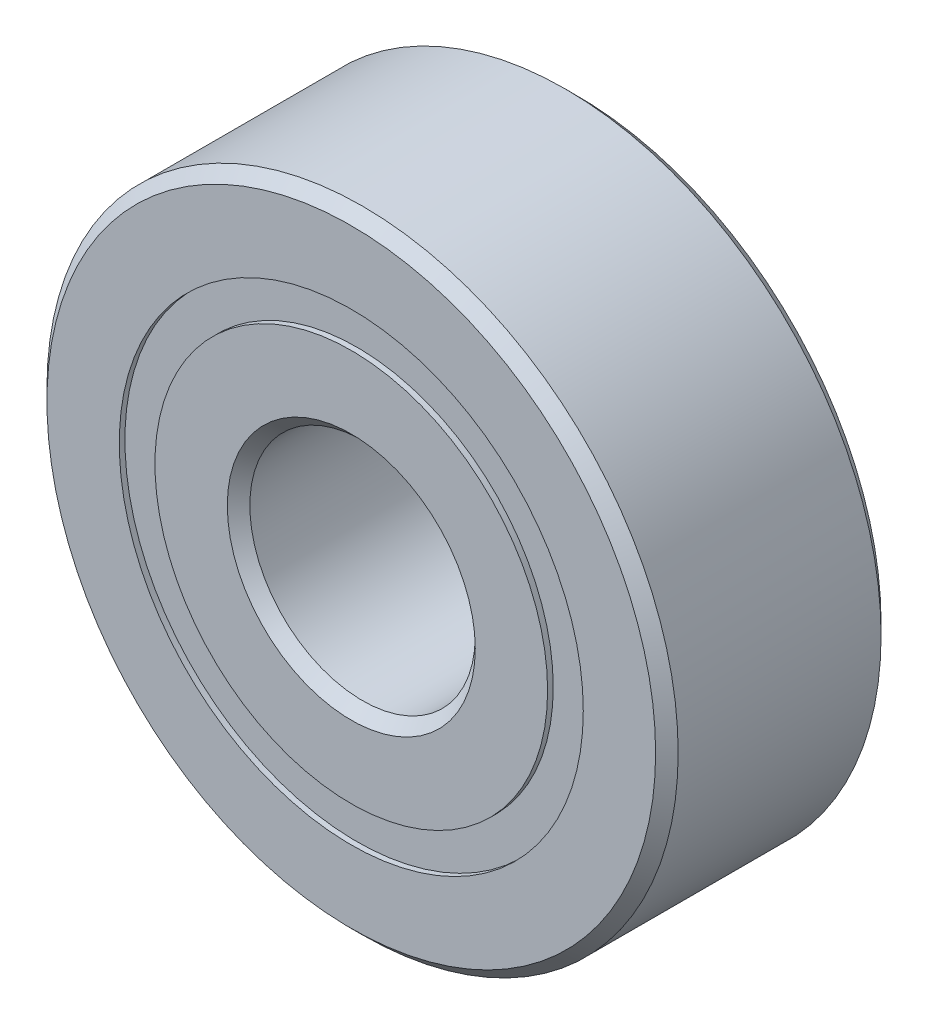
from build123d import *

# Parameters (mm, degrees)
CIRPATTERN1_COUNT = 12
SKETCH5_W         = 1.195563381
SKETCH5_H         = 0.791208792


with BuildPart() as part:
    # Sketch1 → Revolve1 (revolve)
    with BuildSketch(Plane(origin=(0, 0, 0), x_dir=(0, 0, -1), z_dir=(1, 0, 0)), mode=Mode.PRIVATE) as revolve1_sk:
        with BuildLine():
            Line((2.25, 7), (-2.25, 7))
            Line((-2.25, 7), (-2.5, 6.75))
            Line((-2.5, 6.75), (-2.5, 5.145604396))
            Line((-2.5, 5.145604396), (-1.111111111, 5.145604396))
            ThreePointArc((-1.111111111, 5.145604396), (0, 5.929436619), (1.111111111, 5.145604396))
            Line((1.111111111, 5.145604396), (2.5, 5.145604396))
            Line((2.5, 5.145604396), (2.5, 6.75))
            Line((2.5, 6.75), (2.25, 7))
        make_face()
    revolve(revolve1_sk.sketch.rotate(Axis((0, 0, 2.5), (0, 0, -1)), 90), axis=Axis((0, 0, 2.5), (0, 0, -1)))


with BuildPart() as body_2:
    # Sketch3 → Revolve3 (revolve)
    with BuildSketch(Plane(origin=(0, 0, 0), x_dir=(0, 0, -1), z_dir=(1, 0, 0)), mode=Mode.PRIVATE) as revolve3_sk:
        with BuildLine():
            Line((-2.5, 4.354395604), (-1.111111111, 4.354395604))
            ThreePointArc((-1.111111111, 4.354395604), (0, 3.570563381), (1.111111111, 4.354395604))
            Line((1.111111111, 4.354395604), (2.5, 4.354395604))
            Line((2.5, 4.354395604), (2.5, 2.75))
            Line((2.5, 2.75), (2.25, 2.5))
            Line((2.25, 2.5), (-2.25, 2.5))
            Line((-2.25, 2.5), (-2.5, 2.75))
            Line((-2.5, 2.75), (-2.5, 4.354395604))
        make_face()
    revolve(revolve3_sk.sketch.rotate(Axis((0, 0, 2.5), (0, 0, -1)), 90), axis=Axis((0, 0, 2.5), (0, 0, -1)))


with BuildPart() as body_3:
    # Sketch4 → Revolve4 (revolve)
    with BuildSketch(Plane(origin=(0, 0, 0), x_dir=(0, 0, -1), z_dir=(1, 0, 0))):
        with BuildLine():
            Line((-1.179436619, 4.75), (1.179436619, 4.75))
            ThreePointArc((1.179436619, 4.75), (0, 5.929436619), (-1.179436619, 4.75))
        make_face()
    revolve(axis=Axis((0, 4.75, 1.179436619), (0, 0, -1)))


with BuildPart() as cirpattern1_1:
    # CirPattern1: pattern copy
    add(body_3.part.rotate(Axis((0, 0, 0), (0, 0, 1)), 1 * 360 / CIRPATTERN1_COUNT))


with BuildPart() as cirpattern1_2:
    # CirPattern1: pattern copy
    add(body_3.part.rotate(Axis((0, 0, 0), (0, 0, 1)), 2 * 360 / CIRPATTERN1_COUNT))


with BuildPart() as cirpattern1_3:
    # CirPattern1: pattern copy
    add(body_3.part.rotate(Axis((0, 0, 0), (0, 0, 1)), 3 * 360 / CIRPATTERN1_COUNT))


with BuildPart() as cirpattern1_4:
    # CirPattern1: pattern copy
    add(body_3.part.rotate(Axis((0, 0, 0), (0, 0, 1)), 4 * 360 / CIRPATTERN1_COUNT))


with BuildPart() as cirpattern1_5:
    # CirPattern1: pattern copy
    add(body_3.part.rotate(Axis((0, 0, 0), (0, 0, 1)), 5 * 360 / CIRPATTERN1_COUNT))


with BuildPart() as cirpattern1_6:
    # CirPattern1: pattern copy
    add(body_3.part.rotate(Axis((0, 0, 0), (0, 0, 1)), 6 * 360 / CIRPATTERN1_COUNT))


with BuildPart() as cirpattern1_7:
    # CirPattern1: pattern copy
    add(body_3.part.rotate(Axis((0, 0, 0), (0, 0, 1)), 7 * 360 / CIRPATTERN1_COUNT))


with BuildPart() as cirpattern1_8:
    # CirPattern1: pattern copy
    add(body_3.part.rotate(Axis((0, 0, 0), (0, 0, 1)), 8 * 360 / CIRPATTERN1_COUNT))


with BuildPart() as cirpattern1_9:
    # CirPattern1: pattern copy
    add(body_3.part.rotate(Axis((0, 0, 0), (0, 0, 1)), 9 * 360 / CIRPATTERN1_COUNT))


with BuildPart() as cirpattern1_10:
    # CirPattern1: pattern copy
    add(body_3.part.rotate(Axis((0, 0, 0), (0, 0, 1)), 10 * 360 / CIRPATTERN1_COUNT))


with BuildPart() as cirpattern1_11:
    # CirPattern1: pattern copy
    add(body_3.part.rotate(Axis((0, 0, 0), (0, 0, 1)), 11 * 360 / CIRPATTERN1_COUNT))


with BuildPart() as body_15:
    # Sketch5 → Revolve5 (revolve)
    with BuildSketch(Plane(origin=(0, 0, 0), x_dir=(0, 0, -1), z_dir=(1, 0, 0)), mode=Mode.PRIVATE) as revolve5_sk:
        with Locations((-1.77721831, 4.75)):
            Rectangle(SKETCH5_W, SKETCH5_H)
        with Locations((1.77721831, 4.75)):
            Rectangle(SKETCH5_W, SKETCH5_H)
    revolve(revolve5_sk.sketch.rotate(Axis((0, 0, 2.5), (0, 0, -1)), 90), axis=Axis((0, 0, 2.5), (0, 0, -1)))


solid = Compound([part.part, body_2.part, body_3.part, cirpattern1_1.part, cirpattern1_2.part, cirpattern1_3.part, cirpattern1_4.part, cirpattern1_5.part, cirpattern1_6.part, cirpattern1_7.part, cirpattern1_8.part, cirpattern1_9.part, cirpattern1_10.part, cirpattern1_11.part, body_15.part])
